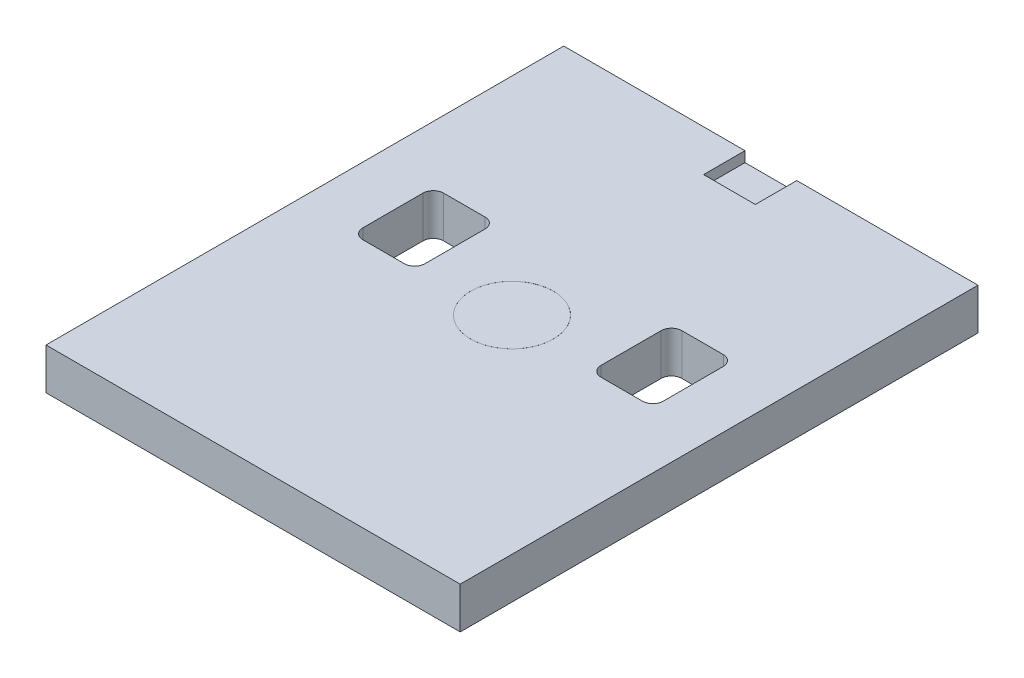
from build123d import *

# Parameters (mm, degrees)
SKETCH2_W          = 254
SKETCH2_H          = 317.5
EXTRUDE1_DEPTH     = 25.4
SKETCH3_R          = 25.4
SKETCH3_R_2        = 25.3746
CUT_EXTRUDE1_DEPTH = 205.879775722
SKETCH4_W          = 31.75
SKETCH4_H          = 64.584514738
CUT_EXTRUDE2_DEPTH = 6.35


with BuildPart() as part:
    # Sketch2 → Extrude1 (new body)
    with BuildSketch(Plane(origin=(0, 0, 0), x_dir=(1, 0, 0), z_dir=(0, 1, 0))):
        Rectangle(SKETCH2_W, SKETCH2_H)
        with BuildLine():
            Line((60.325, 43.815), (85.725, 43.815))
            ThreePointArc((85.725, 43.815), (90.215128061, 41.955128061), (92.075, 37.465))
            Line((92.075, 37.465), (92.075, 0.635))
            ThreePointArc((92.075, 0.635), (90.215128061, -3.855128061), (85.725, -5.715))
            Line((85.725, -5.715), (60.325, -5.715))
            ThreePointArc((60.325, -5.715), (55.834871939, -3.855128061), (53.975, 0.635))
            Line((53.975, 0.635), (53.975, 37.465))
            ThreePointArc((53.975, 37.465), (55.834871939, 41.955128061), (60.325, 43.815))
        make_face(mode=Mode.SUBTRACT)
        with BuildLine():
            Line((-53.975, 37.465), (-53.975, 0.635))
            ThreePointArc((-53.975, 0.635), (-55.834871939, -3.855128061), (-60.325, -5.715))
            Line((-60.325, -5.715), (-85.725, -5.715))
            ThreePointArc((-85.725, -5.715), (-90.215128061, -3.855128061), (-92.075, 0.635))
            Line((-92.075, 0.635), (-92.075, 37.465))
            ThreePointArc((-92.075, 37.465), (-90.215128061, 41.955128061), (-85.725, 43.815))
            Line((-85.725, 43.815), (-60.325, 43.815))
            ThreePointArc((-60.325, 43.815), (-55.834871939, 41.955128061), (-53.975, 37.465))
        make_face(mode=Mode.SUBTRACT)
    extrude(amount=EXTRUDE1_DEPTH)

    # Sketch3 → Cut-Extrude1 (cut, through all)
    with BuildSketch(Plane(origin=(0, 0, 0), x_dir=(1, 0, 0), z_dir=(0, 1, 0))):
        with Locations(Location((0, 0, 0), (0, 0, 270))):
            Circle(SKETCH3_R)
        with Locations(Location((0, 0, 0), (0, 0, 270))):
            Circle(SKETCH3_R_2, mode=Mode.SUBTRACT)
    extrude(amount=CUT_EXTRUDE1_DEPTH, mode=Mode.SUBTRACT)


with BuildPart() as cut_extrude1_piece_1:
    # of the separate pieces the step leaves, piece 1, a body of its own (cut_extrude1_pieces)
    add(part.part.solids().sort_by_distance((127, 0, -158.75))[0])

    # Sketch4 → Cut-Extrude2 (cut)
    with BuildSketch(Plane(origin=(0, 25.4, 0), x_dir=(1, 0, 0), z_dir=(0, 1, 0))):
        with Locations((0, 165.642257369)):
            Rectangle(SKETCH4_W, SKETCH4_H)
    extrude(amount=-CUT_EXTRUDE2_DEPTH, mode=Mode.SUBTRACT)


with BuildPart() as cut_extrude1_piece_2:
    # of the separate pieces the step leaves, piece 2, a body of its own (cut_extrude1_pieces)
    add(part.part.solids().sort_by_distance((0, 0, 25.3746))[0])


solid = Compound([cut_extrude1_piece_1.part, cut_extrude1_piece_2.part])
